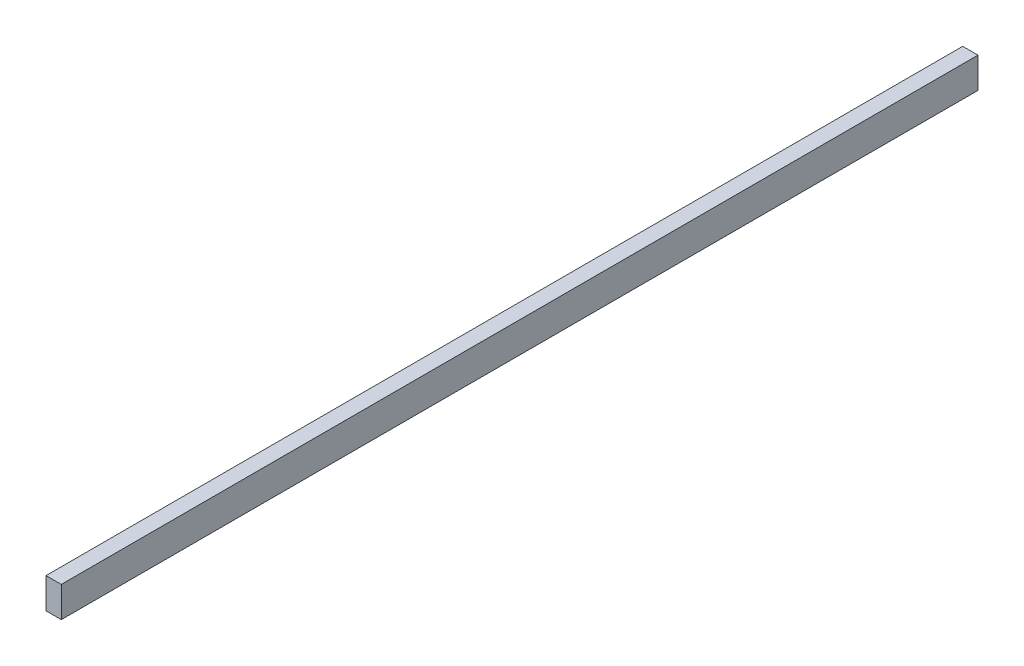
from build123d import *

# Parameters (mm, degrees)
SKETCH1_W           = 25.4
SKETCH1_H           = 50.8
BOSS_EXTRUDE1_DEPTH = 1524


with BuildPart() as part:
    # Sketch1 → Boss-Extrude1 (new body)
    with BuildSketch(Plane.XY):
        with Locations((-66.067126562, 1.959480316)):
            Rectangle(SKETCH1_W, SKETCH1_H)
    extrude(amount=BOSS_EXTRUDE1_DEPTH)


solid = part.part
